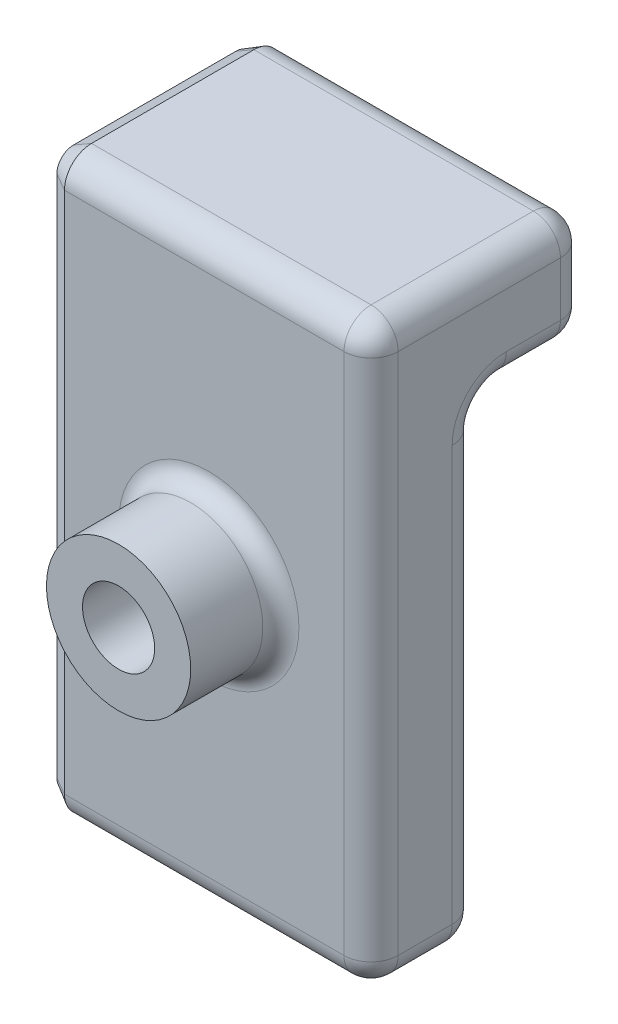
from build123d import *
from OCP.BRepFilletAPI import BRepFilletAPI_MakeChamfer

# Parameters (mm, degrees)
BOSS_EXTRUDE1_DEPTH = 18
SKETCH3_R           = 2
CUT_EXTRUDE1_DEPTH  = 18
FILLET1_R           = 1.5
CHAMFER1_SIZE       = 1
CHAMFER1_SIZE2      = 0.577350269
BOSS_EXTRUDE2_START = 5
SKETCH4_R           = 4
SKETCH4_R_2         = 2
BOSS_EXTRUDE2_DEPTH = 5
FILLET3_R           = 1


with BuildPart() as part:
    # Sketch2 → Boss-Extrude1 (new body)
    with BuildSketch(Plane(origin=(0, 0, 0), x_dir=(0, 0, -1), z_dir=(1, 0, 0))):
        Polygon((0, 0), (0, 32), (12, 32), (12, 26), (6, 26), (6, 0), align=None)
    extrude(amount=BOSS_EXTRUDE1_DEPTH)

    # Sketch3 → Cut-Extrude1 (cut)
    with BuildSketch(Plane.XY):
        with Locations((9, 16)):
            Circle(SKETCH3_R)
    extrude(amount=-CUT_EXTRUDE1_DEPTH, mode=Mode.SUBTRACT)

    # Fillet1
    fillet1_edges = [part.edges().sort_by_distance(p)[0] for p in [
        (9, 0, 0),
        (9, 32, 0),
        (9, 32, -12),
        (9, 26, -12),
        (9, 26, -6),
        (9, 0, -6),
        (18, 26, -9),
        (18, 29, -12),
        (18, 32, -6),
        (18, 16, 0),
        (18, 0, -3),
        (18, 13, -6),
    ]]
    fillet(fillet1_edges, radius=FILLET1_R)

    # Chamfer1: one chamfer whose edges measure the first distance from different faces: ONE call of the kernel's chamfer builder (chamfer() names one face for all edges)
    chamfer1_edges_1 = [part.edges().sort_by_distance(p)[0] for p in [
        (0, 13, -6),
    ]]
    chamfer1_side_1 = [part.faces().sort_by_distance(p)[0] for p in [
        (8.224314761, 12.897259044, -6),
    ]]
    chamfer1_edges_2 = [part.edges().sort_by_distance(p)[0] for p in [
        (0, 16, 0),
    ]]
    chamfer1_side_2 = [part.faces().sort_by_distance(p)[0] for p in [
        (0.333654012, 16, 0),
    ]]
    chamfer1_edges_3 = [part.edges().sort_by_distance(p)[0] for p in [
        (0, 0, -3),
    ]]
    chamfer1_side_3 = [part.faces().sort_by_distance(p)[0] for p in [
        (8.25, 0, -3),
    ]]
    chamfer1_edges_4 = [part.edges().sort_by_distance(p)[0] for p in [
        (0, 32, -6),
    ]]
    chamfer1_side_4 = [part.faces().sort_by_distance(p)[0] for p in [
        (8.25, 32, -6),
    ]]
    chamfer1_edges_5 = [part.edges().sort_by_distance(p)[0] for p in [
        (0, 29, -12),
    ]]
    chamfer1_side_5 = [part.faces().sort_by_distance(p)[0] for p in [
        (8.25, 29, -12),
    ]]
    chamfer1_edges_6 = [part.edges().sort_by_distance(p)[0] for p in [
        (0, 26, -9),
    ]]
    chamfer1_side_6 = [part.faces().sort_by_distance(p)[0] for p in [
        (8.25, 26, -9),
    ]]
    chamfer1_edges_7 = [part.edges().sort_by_distance(p)[0] for p in [
        (0, 31.560660172, -11.560660172),
    ]]
    chamfer1_side_7 = [part.faces().sort_by_distance(p)[0] for p in [
        (8.25, 31.560660172, -11.560660172),
    ]]
    chamfer1_edges_8 = [part.edges().sort_by_distance(p)[0] for p in [
        (0, 26.439339828, -11.560660172),
    ]]
    chamfer1_side_8 = [part.faces().sort_by_distance(p)[0] for p in [
        (8.25, 26.439339828, -11.560660172),
    ]]
    chamfer1_edges_9 = [part.edges().sort_by_distance(p)[0] for p in [
        (0, 0.439339828, -0.439339828),
    ]]
    chamfer1_side_9 = [part.faces().sort_by_distance(p)[0] for p in [
        (8.25, 0.439339828, -0.439339828),
    ]]
    chamfer1_edges_10 = [part.edges().sort_by_distance(p)[0] for p in [
        (0, 0.439339828, -5.560660172),
    ]]
    chamfer1_side_10 = [part.faces().sort_by_distance(p)[0] for p in [
        (8.25, 0.439339828, -5.560660172),
    ]]
    chamfer1_edges_11 = [part.edges().sort_by_distance(p)[0] for p in [
        (0, 31.560660172, -0.439339828),
    ]]
    chamfer1_side_11 = [part.faces().sort_by_distance(p)[0] for p in [
        (8.25, 31.560660172, -0.439339828),
    ]]
    chamfer1_edges_12 = [part.edges().sort_by_distance(p)[0] for p in [
        (0, 25.560660172, -6.439339828),
    ]]
    chamfer1_side_12 = [part.faces().sort_by_distance(p)[0] for p in [
        (8.25, 25.560660172, -6.439339828),
    ]]
    chamfer1 = BRepFilletAPI_MakeChamfer(part.part.solid().wrapped)
    for e in chamfer1_edges_1:
        chamfer1.Add(CHAMFER1_SIZE, CHAMFER1_SIZE2, e.wrapped, chamfer1_side_1[0].wrapped)  # the first distance lies on this face
    for e in chamfer1_edges_2:
        chamfer1.Add(CHAMFER1_SIZE, CHAMFER1_SIZE2, e.wrapped, chamfer1_side_2[0].wrapped)  # the first distance lies on this face
    for e in chamfer1_edges_3:
        chamfer1.Add(CHAMFER1_SIZE, CHAMFER1_SIZE2, e.wrapped, chamfer1_side_3[0].wrapped)  # the first distance lies on this face
    for e in chamfer1_edges_4:
        chamfer1.Add(CHAMFER1_SIZE, CHAMFER1_SIZE2, e.wrapped, chamfer1_side_4[0].wrapped)  # the first distance lies on this face
    for e in chamfer1_edges_5:
        chamfer1.Add(CHAMFER1_SIZE, CHAMFER1_SIZE2, e.wrapped, chamfer1_side_5[0].wrapped)  # the first distance lies on this face
    for e in chamfer1_edges_6:
        chamfer1.Add(CHAMFER1_SIZE, CHAMFER1_SIZE2, e.wrapped, chamfer1_side_6[0].wrapped)  # the first distance lies on this face
    for e in chamfer1_edges_7:
        chamfer1.Add(CHAMFER1_SIZE, CHAMFER1_SIZE2, e.wrapped, chamfer1_side_7[0].wrapped)  # the first distance lies on this face
    for e in chamfer1_edges_8:
        chamfer1.Add(CHAMFER1_SIZE, CHAMFER1_SIZE2, e.wrapped, chamfer1_side_8[0].wrapped)  # the first distance lies on this face
    for e in chamfer1_edges_9:
        chamfer1.Add(CHAMFER1_SIZE, CHAMFER1_SIZE2, e.wrapped, chamfer1_side_9[0].wrapped)  # the first distance lies on this face
    for e in chamfer1_edges_10:
        chamfer1.Add(CHAMFER1_SIZE, CHAMFER1_SIZE2, e.wrapped, chamfer1_side_10[0].wrapped)  # the first distance lies on this face
    for e in chamfer1_edges_11:
        chamfer1.Add(CHAMFER1_SIZE, CHAMFER1_SIZE2, e.wrapped, chamfer1_side_11[0].wrapped)  # the first distance lies on this face
    for e in chamfer1_edges_12:
        chamfer1.Add(CHAMFER1_SIZE, CHAMFER1_SIZE2, e.wrapped, chamfer1_side_12[0].wrapped)  # the first distance lies on this face
    add(Compound.cast(chamfer1.Shape()), mode=Mode.REPLACE)

    # Sketch4 → Boss-Extrude2 (add)
    with BuildSketch(Plane.XY.offset(BOSS_EXTRUDE2_START)):
        with Locations(Location((9, 16, 0), (0, 0, 180))):
            Circle(SKETCH4_R)
        with Locations((9, 16)):
            Circle(SKETCH4_R_2, mode=Mode.SUBTRACT)
    extrude(amount=-BOSS_EXTRUDE2_DEPTH)

    # Fillet3
    fillet3_edges = [part.edges().sort_by_distance(p)[0] for p in [
        (13, 16, 0),
    ]]
    fillet(fillet3_edges, radius=FILLET3_R)


solid = part.part
